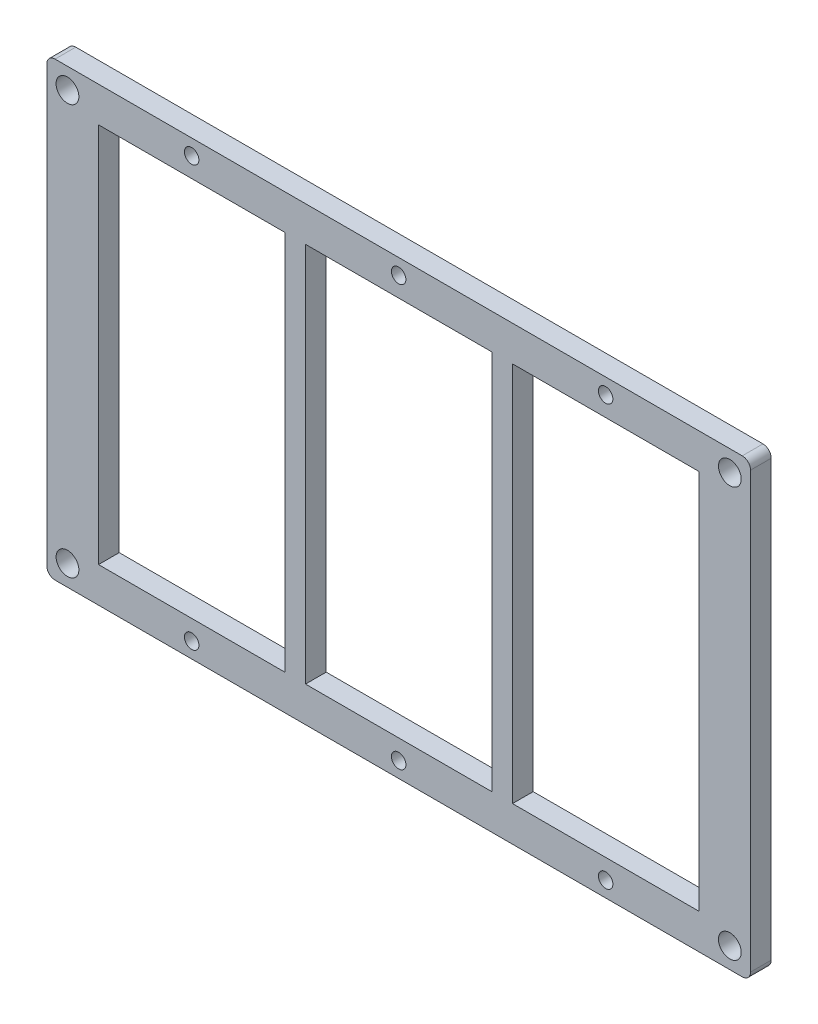
from build123d import *

# Parameters (mm, degrees)
SKETCH1_W            = 55
SKETCH1_H            = 109
SKETCH1_W_2          = 45
SKETCH1_H_2          = 92
BOSS_EXTRUDE1_DEPTH  = 5
SKETCH2_R            = 1.75
CUT_EXTRUDE1_DEPTH   = 62.249489794
LPATTERN1_COUNT      = 3
LPATTERN1_PITCH      = 50
SKETCH3_W            = 7.5
SKETCH3_H            = 109
BOSS_EXTRUDE2_DEPTH  = 5
M5_CLEARANCE_HOLE1_D = 5.5
FILLET1_R            = 2


with BuildPart() as part:
    # Sketch1 → Boss-Extrude1 (new body)
    with BuildSketch(Plane.XY):
        Rectangle(SKETCH1_W, SKETCH1_H)
        Rectangle(SKETCH1_W_2, SKETCH1_H_2, mode=Mode.SUBTRACT)
    extrude(amount=BOSS_EXTRUDE1_DEPTH)

    # Sketch2 → Cut-Extrude1 (cut, through all)
    with BuildSketch(Plane.XY.offset(5)):
        with Locations((0, 50.75)):
            Circle(SKETCH2_R)
        with Locations((0, -50.75)):
            Circle(SKETCH2_R)
    extrude(amount=-CUT_EXTRUDE1_DEPTH, mode=Mode.SUBTRACT)

    # LPattern1: part ×3


with BuildPart() as part_1:
    add(part.part)
    with Locations(*[(i * LPATTERN1_PITCH, 0, 0) for i in range(1, LPATTERN1_COUNT)]):
        add(part.part)

    # Sketch3 → Boss-Extrude2 (add)
    with BuildSketch(Plane.XY.offset(5)):
        with Locations((-31.25, 0)):
            Rectangle(SKETCH3_W, SKETCH3_H)
        with Locations((131.25, 0)):
            Rectangle(SKETCH3_W, SKETCH3_H)
    extrude(amount=-BOSS_EXTRUDE2_DEPTH)

    # M5 Clearance Hole1 (through all)
    with Locations(Plane.XY.offset(5)):
        with Locations((-30, 49.5), (130, 49.5), (130, -49.5), (-30, -49.5)):
            Hole(M5_CLEARANCE_HOLE1_D / 2)

    # Fillet1
    fillet1_edges = [part_1.edges().sort_by_distance(p)[0] for p in [
        (-35, -54.5, 2.5),
        (-35, 54.5, 2.5),
        (135, 54.5, 2.5),
        (135, -54.5, 2.5),
    ]]
    fillet(fillet1_edges, radius=FILLET1_R)


solid = part_1.part
